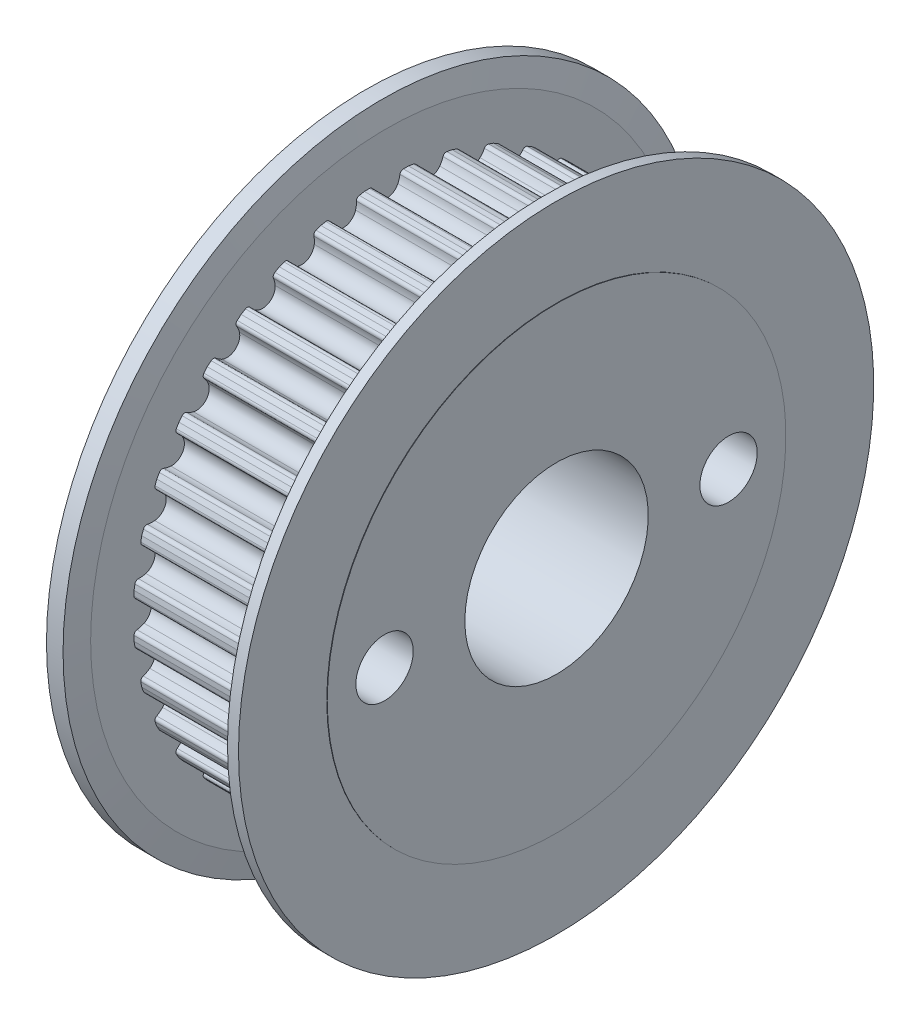
from build123d import *

# Parameters (mm, degrees)
SKETCH_2_R               = 2.5
BORE_DEPTH               = 27.343116794
TEETH_DEPTH              = 6.5
SKETCH_4_R               = 1.5
FIX_2_DEPTH              = 27.343116794
PATTERN_CIRCULAR_3_COUNT = 36
CROQUIS2_R               = 15.841721455
CORTAR_EXTRUIR1_DEPTH    = 9.18
CROQUIS3_R               = 4
CROQUIS3_R_2             = 1.25
CORTAR_EXTRUIR2_DEPTH    = 22.375972549


with BuildPart() as part:
    # Эскиз1 → Body (revolve)
    with BuildSketch(Plane.XY, mode=Mode.PRIVATE) as body_sk:
        Polygon((0, 9.786049427), (0, 0), (17.5, 0), (17.5, 10), (17.48, 10), (17.48, 13.85), (16.99969124, 13.85), (16.58, 12.896693753), (16.58, 11.05), (10.08, 11.05), (10.08, 12.896693753), (9.903188012, 13.92317856), (9.18, 13.92317856), (9.18, 9.85), (0.064328516, 9.85), align=None)
    revolve(body_sk.sketch.rotate(Axis((0, 0, 0), (1, 0, 0)), 90), axis=Axis((0, 0, 0), (1, 0, 0)))

    # Эскиз2 → Bore (cut, through all)
    with BuildSketch(Plane(origin=(17.5, 0, 0), x_dir=(0, 0, -1), z_dir=(1, 0, 0))):
        Circle(SKETCH_2_R)
    extrude(amount=-BORE_DEPTH, mode=Mode.SUBTRACT)

    # Эскиз3 → Teeth (cut)
    with BuildSketch(Plane(origin=(10.08, 0, 0), x_dir=(0, 0, -1), z_dir=(1, 0, 0))):
        with BuildLine():
            Line((0.739871708, 11.004279791), (1.004154512, 11.004279791))
            Line((1.004154512, 11.004279791), (1.082252627, 11.476297828))
            Line((1.082252627, 11.476297828), (-1.096426889, 11.476297828))
            Line((-1.096426889, 11.476297828), (-1.000303717, 11.004279791))
            Line((-1.000303717, 11.004279791), (-0.740479142, 11.004279791))
            ThreePointArc((-0.740479142, 11.004279791), (-0.641572071, 10.967051203), (-0.591760608, 10.873845008))
            ThreePointArc((-0.591760608, 10.873845008), (-0.557915431, 10.716217637), (-0.499180121, 10.566077544))
            ThreePointArc((-0.499180121, 10.566077544), (-0.000303717, 10.254279791), (0.498572688, 10.566077544))
            ThreePointArc((0.498572688, 10.566077544), (0.557307998, 10.716217637), (0.591153175, 10.873845008))
            ThreePointArc((0.591153175, 10.873845008), (0.640964637, 10.967051203), (0.739871708, 11.004279791))
        make_face()
    teeth = extrude(amount=TEETH_DEPTH, mode=Mode.SUBTRACT)

    # Эскиз4 → Fix 2 (cut, through all)
    with BuildSketch(Plane.XY):
        with Locations(Location((5, 0, 0), (0, 0, 180))):
            Circle(SKETCH_4_R)
    extrude(amount=FIX_2_DEPTH, mode=Mode.SUBTRACT)

    # Круговой массив3: Teeth ×36 about axis
    pattern_circular_3_axis = Axis((0, 0, 0), (1, 0, 0))
    for i in range(1, PATTERN_CIRCULAR_3_COUNT):
        add(teeth.rotate(pattern_circular_3_axis, i * 360 / PATTERN_CIRCULAR_3_COUNT), mode=Mode.SUBTRACT)

    # Croquis2 → Cortar-Extruir1 (cut)
    with BuildSketch(Plane.ZY):
        Circle(CROQUIS2_R)
    extrude(amount=-CORTAR_EXTRUIR1_DEPTH, mode=Mode.SUBTRACT)

    # Croquis3 → Cortar-Extruir2 (cut, through all)
    with BuildSketch(Plane.ZY.offset(-9.18)):
        Circle(CROQUIS3_R)
        with Locations((-7.5, 0)):
            Circle(CROQUIS3_R_2)
        with Locations((7.5, 0)):
            Circle(CROQUIS3_R_2)
    extrude(amount=-CORTAR_EXTRUIR2_DEPTH, mode=Mode.SUBTRACT)


solid = part.part
